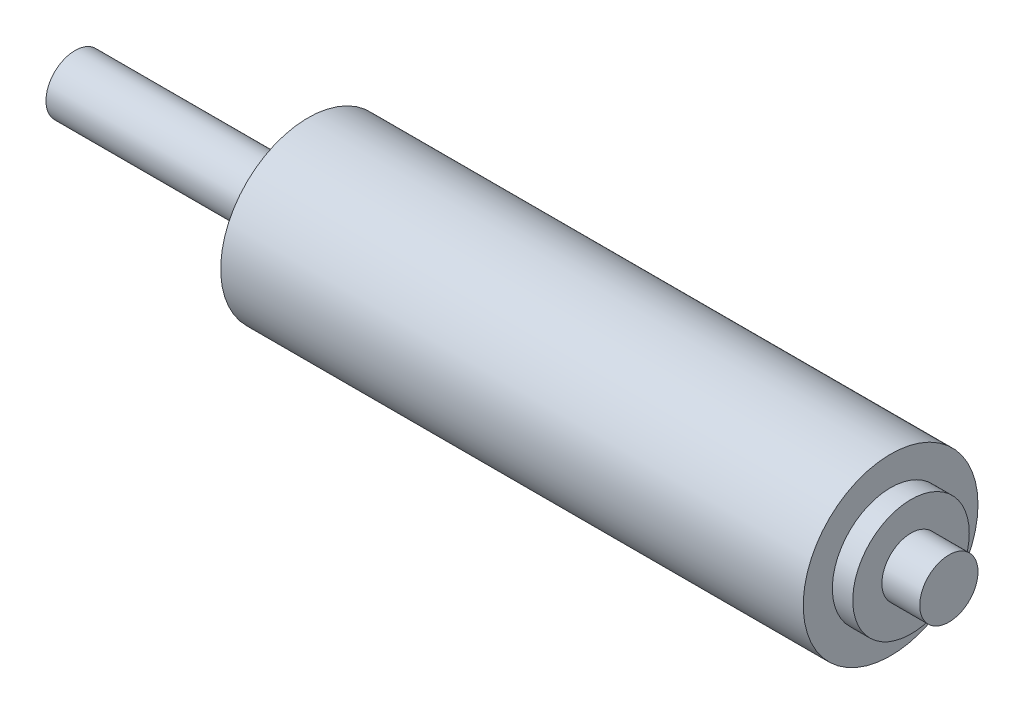
from build123d import *


with BuildPart() as part:
    # 草图1 → 旋转1 (revolve)
    with BuildSketch(Plane.XY, mode=Mode.PRIVATE) as revolve_1_sk:
        Polygon((0, 0), (0, 5), (36.5, 5), (36.5, 10), (40, 10), (40, 15), (140, 15), (140, 10), (143.5, 10), (143.5, 5), (150, 5), (150, 0), align=None)
    revolve(revolve_1_sk.sketch.rotate(Axis((150, 0, 0), (-1, 0, 0)), 90), axis=Axis((150, 0, 0), (-1, 0, 0)))


solid = part.part
